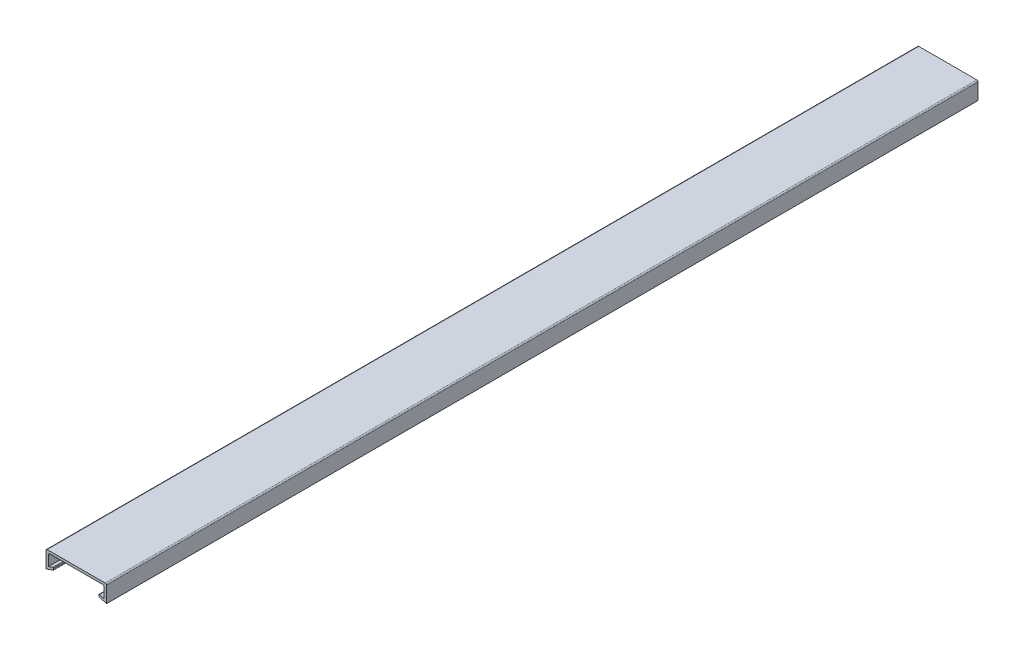
from build123d import *

# Parameters (mm, degrees)
SALIENTE_EXTRUIR1_DEPTH = 176


with BuildPart() as part:
    # Croquis1 → Saliente-Extruir1 (new, symmetric)
    with BuildSketch(Plane.XY):
        with BuildLine():
            Line((-9.336754447, -6.045584816), (-12.2, -7))
            Line((-12.2, -7), (-12.2, -0.5))
            ThreePointArc((-12.2, -0.5), (-12.053553391, -0.146446609), (-11.7, 0))
            Line((-11.7, 0), (11.7, 0))
            ThreePointArc((11.7, 0), (12.053553391, -0.146446609), (12.2, -0.5))
            Line((12.2, -0.5), (12.2, -7))
            Line((12.2, -7), (9.336754447, -6.045584816))
            ThreePointArc((9.336754447, -6.045584816), (9.237751563, -5.972790213), (9.2, -5.855848156))
            Line((9.2, -5.855848156), (9.2, -5.277485177))
            ThreePointArc((9.2, -5.277485177), (9.283057943, -5.11523674), (9.463245553, -5.087748518))
            Line((9.463245553, -5.087748518), (11.2, -5.666666667))
            Line((11.2, -5.666666667), (11.2, -1.5))
            ThreePointArc((11.2, -1.5), (11.053553391, -1.146446609), (10.7, -1))
            Line((10.7, -1), (-10.7, -1))
            ThreePointArc((-10.7, -1), (-11.053553391, -1.146446609), (-11.2, -1.5))
            Line((-11.2, -1.5), (-11.2, -5.666666667))
            Line((-11.2, -5.666666667), (-9.463245553, -5.087748518))
            ThreePointArc((-9.463245553, -5.087748518), (-9.283057943, -5.11523674), (-9.2, -5.277485177))
            Line((-9.2, -5.277485177), (-9.2, -5.855848156))
            ThreePointArc((-9.2, -5.855848156), (-9.237751563, -5.972790213), (-9.336754447, -6.045584816))
        make_face()
    extrude(amount=SALIENTE_EXTRUIR1_DEPTH, both=True)


solid = part.part
